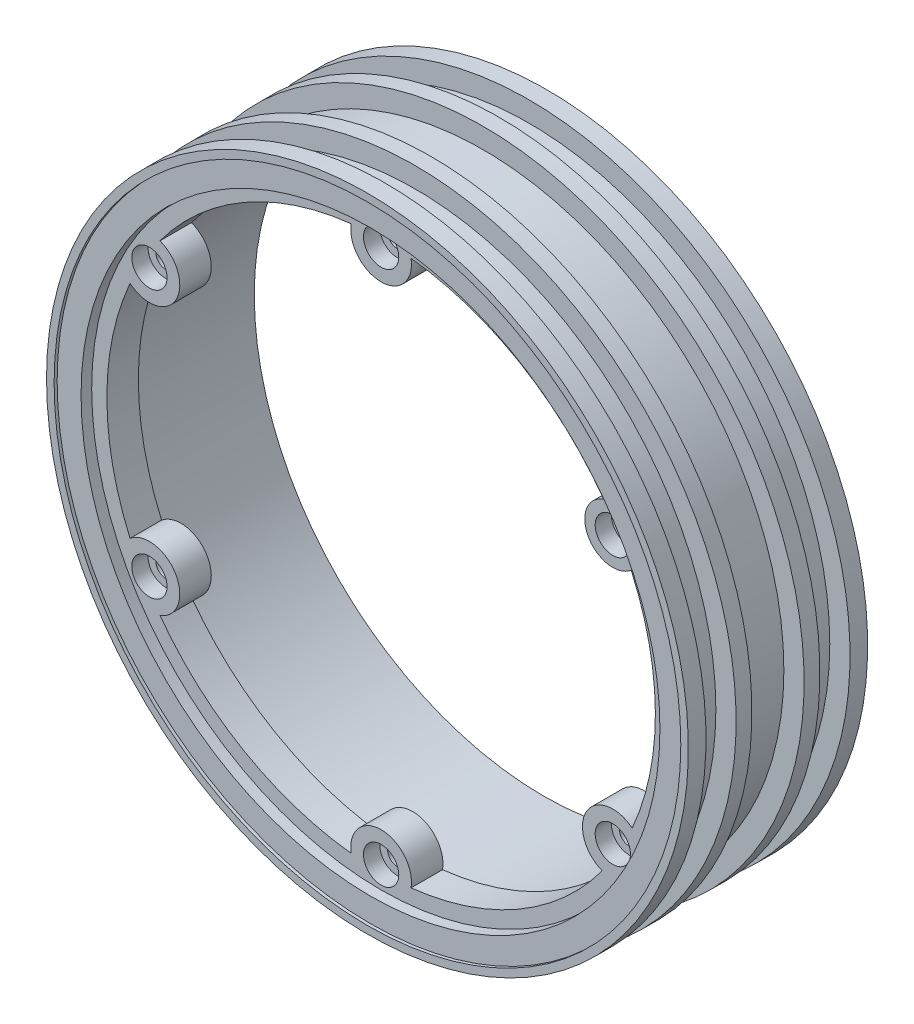
from build123d import *

# Parameters (mm, degrees)
ESTRUSIONE_ESTRUSIONE1_START = -4.15
SCHIZZO2_R                   = 38.135
SCHIZZO2_R_2                 = 1.3
ESTRUSIONE_ESTRUSIONE1_DEPTH = 4.15
SCHIZZO3_R                   = 2.325
TAGLIO_ESTRUSIONE1_DEPTH     = 2.15


with BuildPart() as part:
    # Schizzo1 → Rivoluzione1 (revolve)
    with BuildSketch(Plane(origin=(0, 0, 0), x_dir=(0, 0, -1), z_dir=(1, 0, 0)), mode=Mode.PRIVATE) as rivoluzione1_sk:
        Polygon((-11.41, 38.135), (11.41, 38.135), (11.41, 41.285), (11.81, 41.285), (11.81, 42.285), (9.49, 42.285), (9.49, 39.615), (5.52, 39.615), (5.52, 42.285), (3.44, 42.285), (3.44, 39.615), (-3.44, 39.615), (-3.44, 42.285), (-5.52, 42.285), (-5.52, 39.615), (-9.49, 39.615), (-9.49, 42.285), (-11.81, 42.285), (-11.81, 41.285), (-11.41, 41.285), align=None)
    revolve(rivoluzione1_sk.sketch.rotate(Axis((0, 0, 0), (0, 0, 1)), 90), axis=Axis((0, 0, 0), (0, 0, 1)))

    # Schizzo2 → Estrusione-Estrusione1 (add)
    with BuildSketch(Plane.XY.offset(10.01).offset(ESTRUSIONE_ESTRUSIONE1_START)):
        with Locations(Location((0, 0, 0), (0, 0, 180))):
            Circle(SCHIZZO2_R)
        with Locations((0, 35.25)):
            Circle(SCHIZZO2_R_2, mode=Mode.SUBTRACT)
        with Locations((30.527395483, 17.625)):
            Circle(SCHIZZO2_R_2, mode=Mode.SUBTRACT)
        with Locations((30.527395483, -17.625)):
            Circle(SCHIZZO2_R_2, mode=Mode.SUBTRACT)
        with Locations((0, -35.25)):
            Circle(SCHIZZO2_R_2, mode=Mode.SUBTRACT)
        with Locations((-30.527395483, -17.625)):
            Circle(SCHIZZO2_R_2, mode=Mode.SUBTRACT)
        with Locations((-30.527395483, 17.625)):
            Circle(SCHIZZO2_R_2, mode=Mode.SUBTRACT)
        with BuildLine():
            ThreePointArc((-33.078719897, 14.544294929), (-36.135, 0), (-33.078719897, -14.544294929))
            ThreePointArc((-33.078719897, -14.544294929), (-27.063293868, -15.625), (-29.135088837, -21.374864291))
            ThreePointArc((-29.135088837, -21.374864291), (-18.0675, -31.293827966), (-3.94363106, -35.91915922))
            ThreePointArc((-3.94363106, -35.91915922), (0, -31.25), (3.94363106, -35.91915922))
            ThreePointArc((3.94363106, -35.91915922), (18.0675, -31.293827966), (29.135088837, -21.374864291))
            ThreePointArc((29.135088837, -21.374864291), (27.063293868, -15.625), (33.078719897, -14.544294929))
            ThreePointArc((33.078719897, -14.544294929), (36.134649477, 0.159160806), (32.949313569, 14.835125895))
            ThreePointArc((32.949313569, 14.835125895), (27.327893405, 15.777766614), (29.322252678, 21.117379641))
            ThreePointArc((29.322252678, 21.117379641), (18.20516204, 31.213944001), (3.94363106, 35.91915922))
            ThreePointArc((3.94363106, 35.91915922), (0, 31.25), (-3.94363106, 35.91915922))
            ThreePointArc((-3.94363106, 35.91915922), (-18.0675, 31.293827966), (-29.135088837, 21.374864291))
            ThreePointArc((-29.135088837, 21.374864291), (-27.063293868, 15.625), (-33.078719897, 14.544294929))
        make_face(mode=Mode.SUBTRACT)
    extrude(amount=ESTRUSIONE_ESTRUSIONE1_DEPTH)

    # Schizzo3 → Taglio-Estrusione1 (cut)
    with BuildSketch(Plane(origin=(0, 0, 10.01), x_dir=(-1, 0, 0), z_dir=(0, 0, -1))):
        with Locations(Location((30.527395483, -17.625, 0), (0, 0, 180))):
            Circle(SCHIZZO3_R)
        with Locations(Location((0, -35.25, 0), (0, 0, 180))):
            Circle(SCHIZZO3_R)
        with Locations(Location((-30.527395483, -17.625, 0), (0, 0, 180))):
            Circle(SCHIZZO3_R)
        with Locations(Location((-30.527395483, 17.625, 0), (0, 0, 180))):
            Circle(SCHIZZO3_R)
        with Locations(Location((0, 35.25, 0), (0, 0, 180))):
            Circle(SCHIZZO3_R)
        with Locations(Location((30.527395483, 17.625, 0), (0, 0, 180))):
            Circle(SCHIZZO3_R)
    extrude(amount=TAGLIO_ESTRUSIONE1_DEPTH, mode=Mode.SUBTRACT)


solid = part.part
